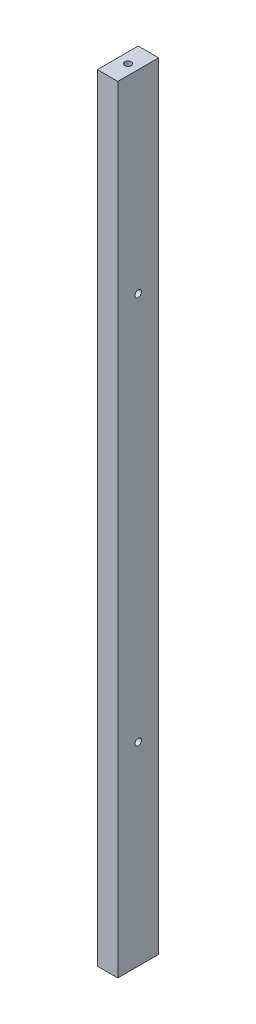
from build123d import *

# Parameters (mm, degrees)
SKETCH_1_W          = 25
SKETCH_1_H          = 50
EXTRUDE_1_DEPTH     = 950
SKETCH_2_R          = 4
CUT_EXTRUDE_1_DEPTH = 950
SKETCH_3_R          = 4
CUT_EXTRUDE_2_DEPTH = 10
CUT_EXTRUDE_START   = -10
SKETCH_4_R          = 4
CUT_EXTRUDE_3_DEPTH = 10


with BuildPart() as part:
    # Эскиз1 → Бобышка-Вытянуть1 (new body)
    with BuildSketch(Plane(origin=(0, 0, 0), x_dir=(1, 0, 0), z_dir=(0, 1, 0))):
        Rectangle(SKETCH_1_W, SKETCH_1_H)
    extrude(amount=EXTRUDE_1_DEPTH)

    # Эскиз2 → Вырез-Вытянуть1 (cut)
    with BuildSketch(Plane(origin=(12.5, 0, 0), x_dir=(0, 0, -1), z_dir=(1, 0, 0))):
        with Locations((0, 712.5)):
            Circle(SKETCH_2_R)
        with Locations((0, 237.5)):
            Circle(SKETCH_2_R)
    extrude(amount=-CUT_EXTRUDE_1_DEPTH, mode=Mode.SUBTRACT)

    # Эскиз3 → Вырез-Вытянуть2 (cut)
    with BuildSketch(Plane(origin=(0, 950, 0), x_dir=(1, 0, 0), z_dir=(0, 1, 0))):
        with Locations(Location((0, 0, 0), (0, 0, 270))):
            Circle(SKETCH_3_R)
    extrude(amount=-CUT_EXTRUDE_2_DEPTH, mode=Mode.SUBTRACT)

    # Эскиз4 → Вырез-Вытянуть3 (cut)
    with BuildSketch(Plane.XZ.offset(CUT_EXTRUDE_START)):
        with Locations(Location((0, 0, 0), (0, 0, 90))):
            Circle(SKETCH_4_R)
    extrude(amount=CUT_EXTRUDE_3_DEPTH, mode=Mode.SUBTRACT)


solid = part.part
